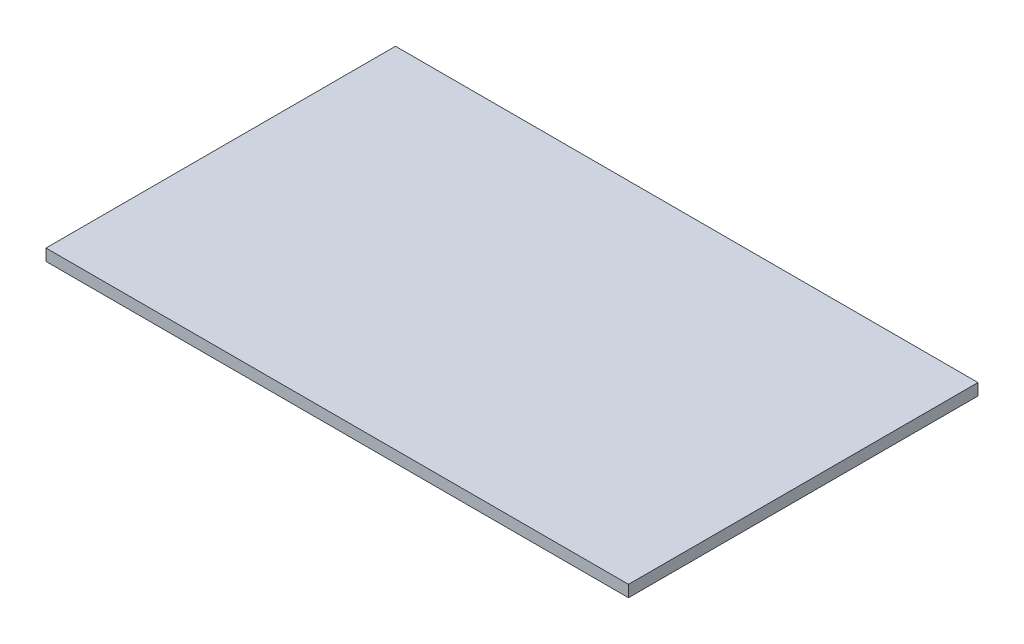
from build123d import *

# Parameters (mm, degrees)
SKETCH1_W           = 500
SKETCH1_H           = 300
BOSS_EXTRUDE1_DEPTH = 10


with BuildPart() as part:
    # Sketch1 → Boss-Extrude1 (new body)
    with BuildSketch(Plane(origin=(0, 0, 0), x_dir=(1, 0, 0), z_dir=(0, 1, 0))):
        Rectangle(SKETCH1_W, SKETCH1_H)
    extrude(amount=BOSS_EXTRUDE1_DEPTH)


solid = part.part
